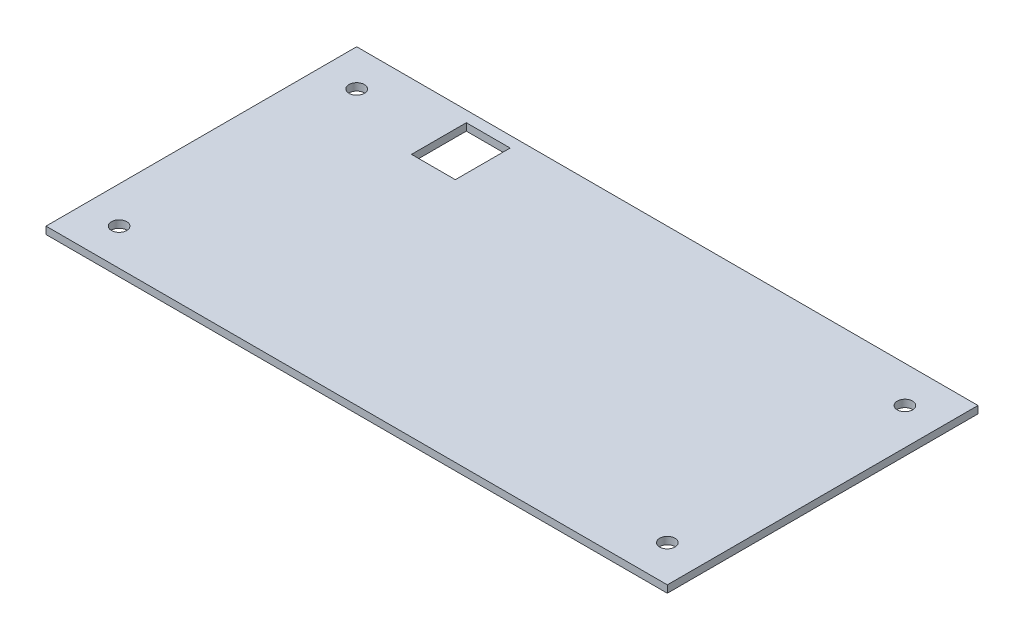
from build123d import *

# Parameters (mm, degrees)
SKETCH2_W           = 170
SKETCH2_H           = 85
BOSS_EXTRUDE1_DEPTH = 2
SKETCH3_W           = 12
SKETCH3_H           = 15
CUT_EXTRUDE1_DEPTH  = 106.73546699
SKETCH13_R          = 2.1
CUT_EXTRUDE5_DEPTH  = 106.73546699


with BuildPart() as part:
    # Sketch2 → Boss-Extrude1 (new body)
    with BuildSketch(Plane(origin=(0, 0, 0), x_dir=(1, 0, 0), z_dir=(0, 1, 0))):
        with Locations((10.400843882, -3.048523207)):
            Rectangle(SKETCH2_W, SKETCH2_H)
    extrude(amount=BOSS_EXTRUDE1_DEPTH)

    # Sketch3 → Cut-Extrude1 (cut, through all)
    with BuildSketch(Plane(origin=(0, 2, 0), x_dir=(1, 0, 0), z_dir=(0, 1, 0))):
        with Locations((-35.599156118, 28.951476793)):
            Rectangle(SKETCH3_W, SKETCH3_H)
    extrude(amount=-CUT_EXTRUDE1_DEPTH, mode=Mode.SUBTRACT)

    # Sketch13 → Cut-Extrude5 (cut, through all)
    with BuildSketch(Plane(origin=(0, 2, 0), x_dir=(1, 0, 0), z_dir=(0, 1, 0))):
        with Locations(Location((-64.599156118, 29.451476793, 0), (0, 0, 270))):
            Circle(SKETCH13_R)
        with Locations(Location((85.400843882, 29.451476793, 0), (0, 0, 270))):
            Circle(SKETCH13_R)
        with Locations(Location((-64.599156118, -35.548523207, 0), (0, 0, 270))):
            Circle(SKETCH13_R)
        with Locations(Location((85.400843882, -35.548523207, 0), (0, 0, 270))):
            Circle(SKETCH13_R)
    extrude(amount=-CUT_EXTRUDE5_DEPTH, mode=Mode.SUBTRACT)


solid = part.part
